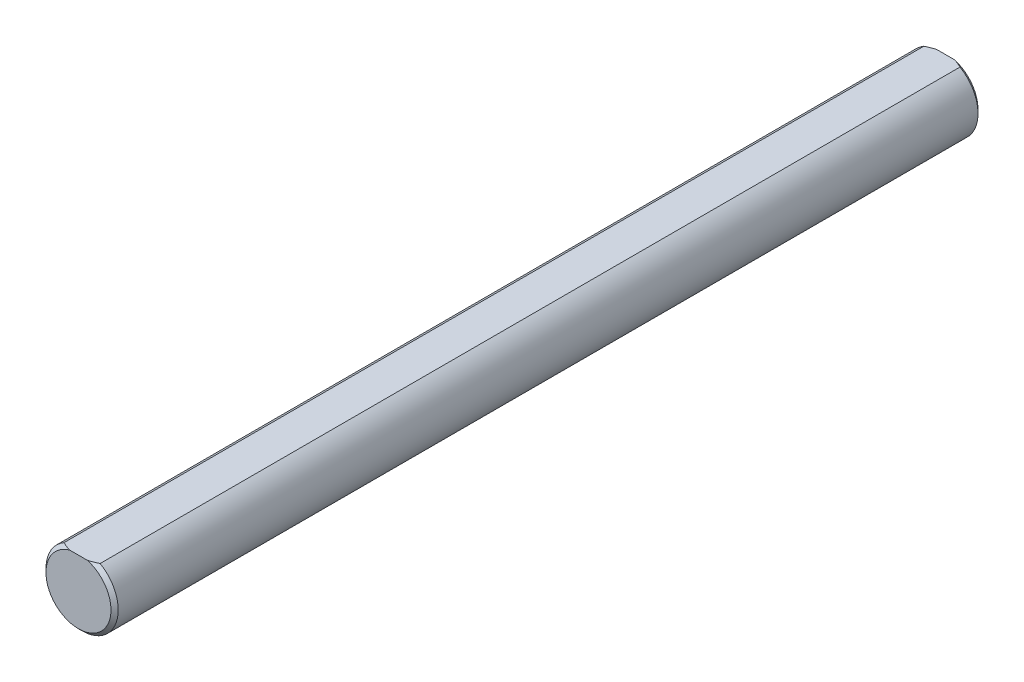
from build123d import *

# Parameters (mm, degrees)
BOSS_EXTRUDE2_DEPTH      = 76.2
BOSS_EXTRUDE2_DEPTH_BACK = 76.2
SKETCH3_R                = 6.35
CUT_EXTRUDE5_DEPTH       = 77.727341932
CUT_EXTRUDE5_DEPTH_BACK  = 77.727341932
CHAMFER1_SIZE            = 0.635


with BuildPart() as part:
    # Sketch3 → Boss-Extrude2 (new, two sides: drawn at the far end of the back side and taken through both)
    with BuildSketch(Plane.XY.offset(-BOSS_EXTRUDE2_DEPTH_BACK)):
        with Locations(Location((0, 0, 0), (0, 0, 180))):
            Circle(SKETCH3_R)
    extrude(amount=BOSS_EXTRUDE2_DEPTH + BOSS_EXTRUDE2_DEPTH_BACK)

    # Sketch10 → Cut-Extrude5 (cut, two sides: drawn at the far end of the back side and taken through both)
    with BuildSketch(Plane.XY.offset(-CUT_EXTRUDE5_DEPTH_BACK)):
        with BuildLine():
            Line((-3.175, 5.499261314), (3.175, 5.499261314))
            ThreePointArc((3.175, 5.499261314), (0, 6.35), (-3.175, 5.499261314))
        make_face()
    extrude(amount=CUT_EXTRUDE5_DEPTH + CUT_EXTRUDE5_DEPTH_BACK, mode=Mode.SUBTRACT)

    # Chamfer1
    chamfer1_edges = [part.edges().sort_by_distance(p)[0] for p in [
        (0, -6.35, -76.2),
        (0, -6.35, 76.2),
    ]]
    chamfer(chamfer1_edges, length=CHAMFER1_SIZE)


solid = part.part
